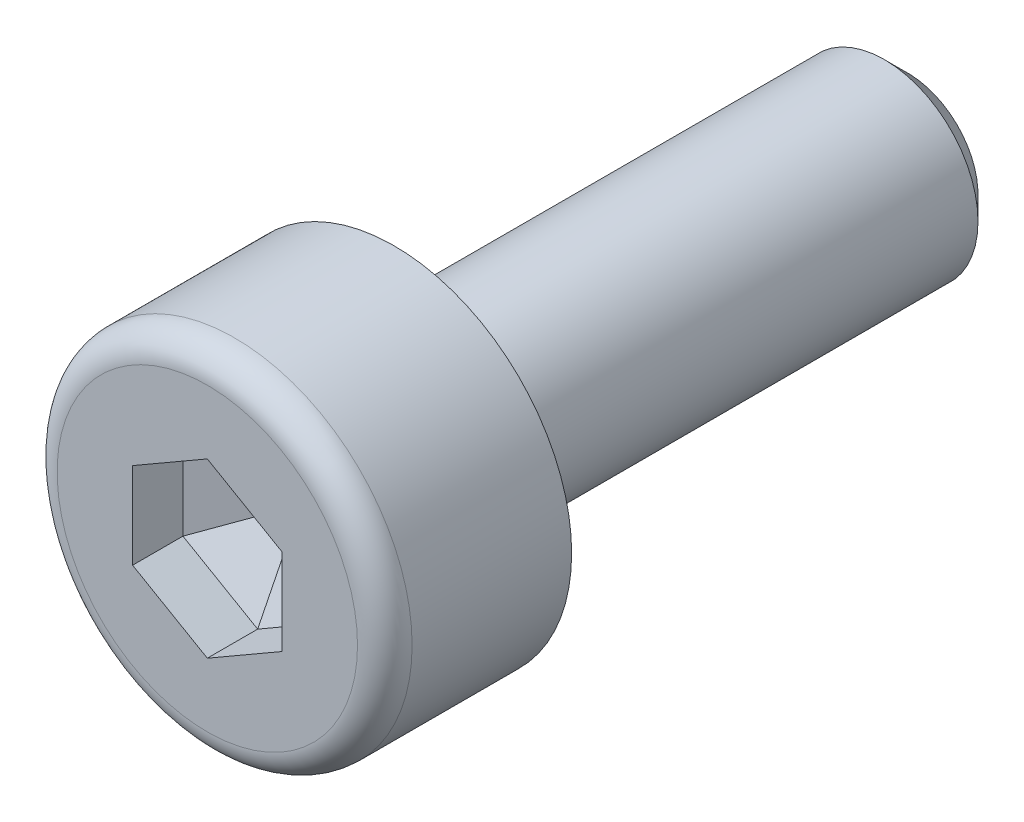
from build123d import *
from OCP.BRepFilletAPI import BRepFilletAPI_MakeChamfer

# Parameters (mm, degrees)
SKETCH_1_R          = 1.9
EXTRUDE_1_DEPTH     = 2
CUT_EXTRUDE_1_DEPTH = 1
SKETCH_3_R          = 1
EXTRUDE_2_DEPTH     = 5.5
CHAMFER_1_SIZE      = 0.25
FILLET_1_R          = 0.292307692
CHAMFER_2_SIZE      = 0.461095101
CHAMFER_2_SIZE2     = 0.798640142
FILLET_2_R          = 0.1


with BuildPart() as part:
    # 草图1 → 凸台-拉伸1 (new body)
    with BuildSketch(Plane.XY):
        Circle(SKETCH_1_R)
    extrude(amount=EXTRUDE_1_DEPTH)

    # 草图2 → 切除-拉伸1 (cut)
    with BuildSketch(Plane.XY.offset(2)):
        Polygon((0.8, 0.461880215), (0, 0.923760431), (-0.8, 0.461880215), (-0.8, -0.461880215), (0, -0.923760431), (0.8, -0.461880215), align=None)
    extrude(amount=-CUT_EXTRUDE_1_DEPTH, mode=Mode.SUBTRACT)

    # 草图3 → 凸台-拉伸2 (add)
    with BuildSketch(Plane(origin=(0, 0, 0), x_dir=(-1, 0, 0), z_dir=(0, 0, -1))):
        Circle(SKETCH_3_R)
    extrude(amount=EXTRUDE_2_DEPTH)

    # 倒角1
    chamfer_1_edges = [part.edges().sort_by_distance(p)[0] for p in [
        (1, 0, -5.5),
    ]]
    chamfer(chamfer_1_edges, length=CHAMFER_1_SIZE)

    # 圆角1
    fillet_1_edges = [part.edges().sort_by_distance(p)[0] for p in [
        (-1.9, 0, 2),
    ]]
    fillet(fillet_1_edges, radius=FILLET_1_R)

    # 倒角2: one chamfer whose edges measure the first distance from different faces: ONE call of the kernel's chamfer builder (chamfer() names one face for all edges)
    chamfer_2_edges_1 = [part.edges().sort_by_distance(p)[0] for p in [
        (-0.8, 0, 1),
    ]]
    chamfer_2_side_1 = [part.faces().sort_by_distance(p)[0] for p in [
        (-0.8, 0, 1.5),
    ]]
    chamfer_2_edges_2 = [part.edges().sort_by_distance(p)[0] for p in [
        (-0.4, 0.692820323, 1),
    ]]
    chamfer_2_side_2 = [part.faces().sort_by_distance(p)[0] for p in [
        (-0.4, 0.692820323, 1.5),
    ]]
    chamfer_2_edges_3 = [part.edges().sort_by_distance(p)[0] for p in [
        (0.4, 0.692820323, 1),
    ]]
    chamfer_2_side_3 = [part.faces().sort_by_distance(p)[0] for p in [
        (0.4, 0.692820323, 1.5),
    ]]
    chamfer_2_edges_4 = [part.edges().sort_by_distance(p)[0] for p in [
        (0.8, 0, 1),
    ]]
    chamfer_2_side_4 = [part.faces().sort_by_distance(p)[0] for p in [
        (0.8, 0, 1.5),
    ]]
    chamfer_2_edges_5 = [part.edges().sort_by_distance(p)[0] for p in [
        (-0.4, -0.692820323, 1),
    ]]
    chamfer_2_side_5 = [part.faces().sort_by_distance(p)[0] for p in [
        (-0.4, -0.692820323, 1.5),
    ]]
    chamfer_2_edges_6 = [part.edges().sort_by_distance(p)[0] for p in [
        (0.4, -0.692820323, 1),
    ]]
    chamfer_2_side_6 = [part.faces().sort_by_distance(p)[0] for p in [
        (0.4, -0.692820323, 1.5),
    ]]
    chamfer_2 = BRepFilletAPI_MakeChamfer(part.part.solid().wrapped)
    for e in chamfer_2_edges_1:
        chamfer_2.Add(CHAMFER_2_SIZE, CHAMFER_2_SIZE2, e.wrapped, chamfer_2_side_1[0].wrapped)  # the first distance lies on this face
    for e in chamfer_2_edges_2:
        chamfer_2.Add(CHAMFER_2_SIZE, CHAMFER_2_SIZE2, e.wrapped, chamfer_2_side_2[0].wrapped)  # the first distance lies on this face
    for e in chamfer_2_edges_3:
        chamfer_2.Add(CHAMFER_2_SIZE, CHAMFER_2_SIZE2, e.wrapped, chamfer_2_side_3[0].wrapped)  # the first distance lies on this face
    for e in chamfer_2_edges_4:
        chamfer_2.Add(CHAMFER_2_SIZE, CHAMFER_2_SIZE2, e.wrapped, chamfer_2_side_4[0].wrapped)  # the first distance lies on this face
    for e in chamfer_2_edges_5:
        chamfer_2.Add(CHAMFER_2_SIZE, CHAMFER_2_SIZE2, e.wrapped, chamfer_2_side_5[0].wrapped)  # the first distance lies on this face
    for e in chamfer_2_edges_6:
        chamfer_2.Add(CHAMFER_2_SIZE, CHAMFER_2_SIZE2, e.wrapped, chamfer_2_side_6[0].wrapped)  # the first distance lies on this face
    add(Compound.cast(chamfer_2.Shape()), mode=Mode.REPLACE)

    # 圆角2
    fillet_2_edges = [part.edges().sort_by_distance(p)[0] for p in [
        (1, 0, 0),
    ]]
    fillet(fillet_2_edges, radius=FILLET_2_R)


solid = part.part
